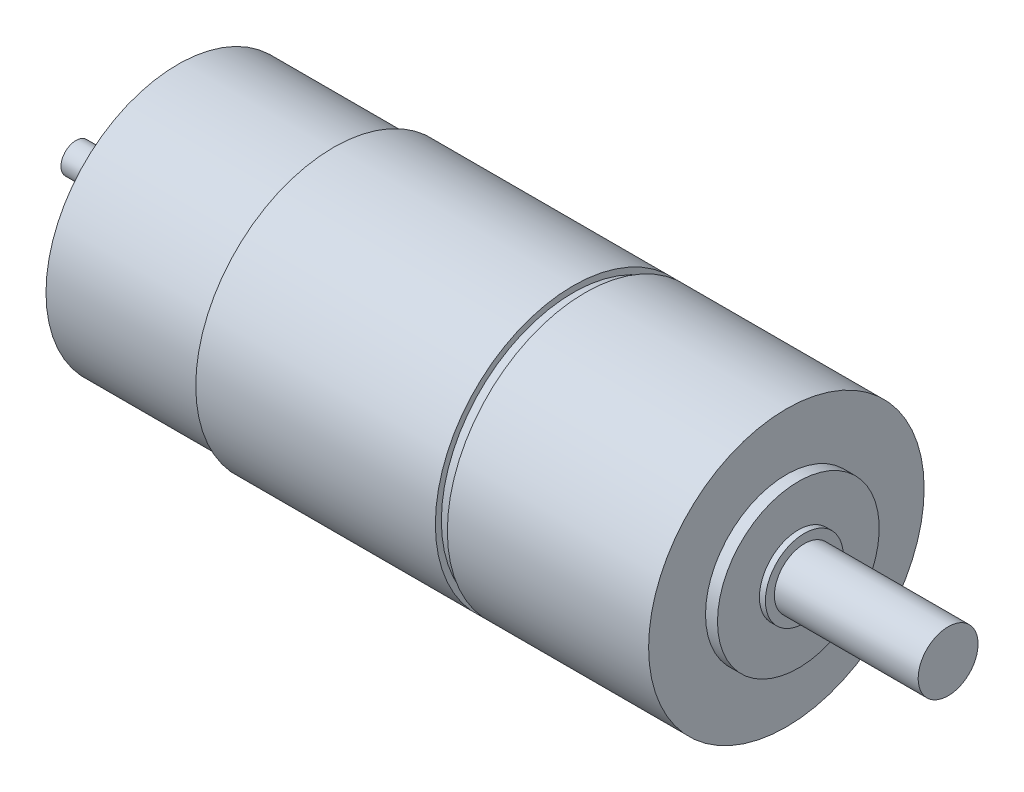
from build123d import *


with BuildPart() as part:
    # Sketch1 → Revolve1 (revolve)
    with BuildSketch(Plane(origin=(0, 0, 0), x_dir=(1, 0, 0), z_dir=(0, 1, 0)), mode=Mode.PRIVATE) as revolve1_sk:
        Polygon((0, 2.5), (0, 0), (19, 0), (19, 20), (116.6, 20), (116.6, 0), (145.6, 0), (145.6, 5), (121.6, 5), (121.6, 6.5), (120.6, 6.5), (120.6, 13.5), (118.6, 13.5), (118.6, 23), (85, 23), (85, 22), (83, 22), (83, 23), (43, 23), (43, 22), (19, 22), (17, 22), (17, 6), (12, 6), (12, 5), (10, 5), (10, 2.5), align=None)
    revolve(revolve1_sk.sketch.rotate(Axis((0, 0, 0), (1, 0, 0)), 180), axis=Axis((0, 0, 0), (1, 0, 0)))


solid = part.part
